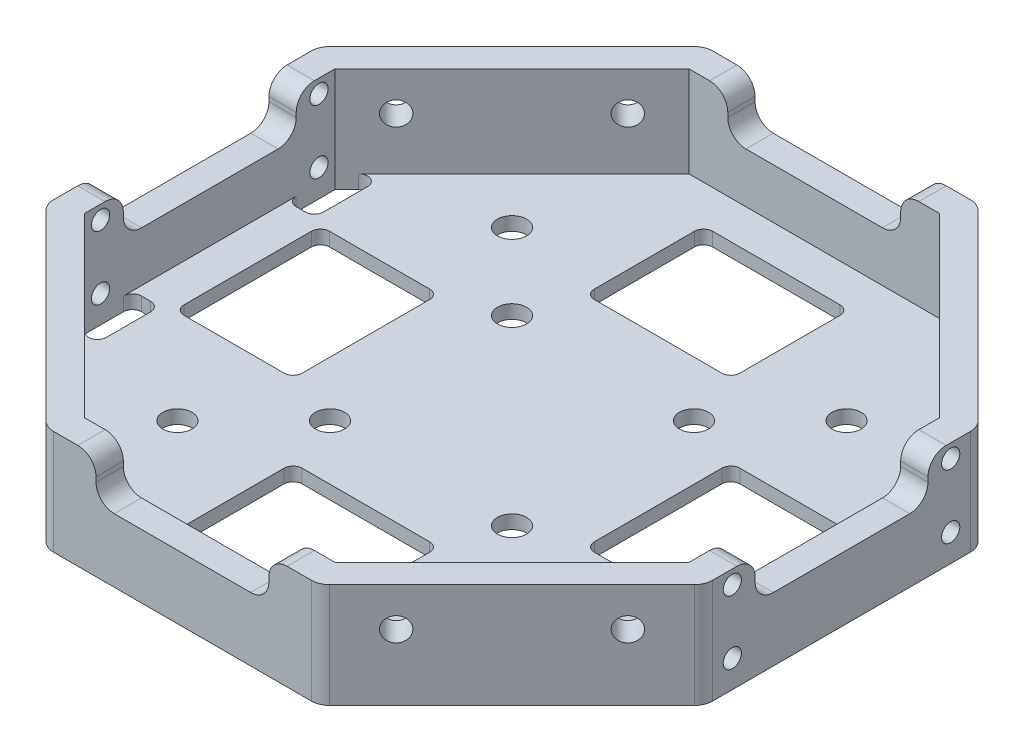
from build123d import *

# Parameters (mm, degrees)
BOSS_EXTRUDE1_DEPTH = 11.5
SHELL1_T            = -3
SKETCH3_R           = 1.3
CUT_EXTRUDE1_DEPTH  = 94
SKETCH4_R           = 1.3
CUT_EXTRUDE2_DEPTH  = 94
FILLET1_R           = 2
CUT_EXTRUDE3_DEPTH  = 79
CUT_EXTRUDE4_DEPTH  = 79
FILLET2_R           = 2
SKETCH7_R           = 1.6
CUT_EXTRUDE5_DEPTH  = 10
SKETCH8_R           = 1
CUT_EXTRUDE7_DEPTH  = 79
CUT_EXTRUDE8_DEPTH  = 1.5
CUT_EXTRUDE9_DEPTH  = 1.5
FILLET3_R           = 1
CUT_EXTRUDE10_DEPTH = 10
FILLET4_R           = 1
SKETCH14_R          = 1.6
CUT_EXTRUDE11_DEPTH = 10


with BuildPart() as part:
    # Sketch1 → Boss-Extrude1 (new body)
    with BuildSketch(Plane(origin=(0, 0, 0), x_dir=(1, 0, 0), z_dir=(0, 1, 0))):
        Polygon((-11.213203436, 40), (18.786796564, 40), (40, 18.786796564), (40, -11.213203436), (18.786796564, -32.426406871), (-11.213203436, -32.426406871), (-32.426406871, -11.213203436), (-32.426406871, 18.786796564), align=None)
    extrude(amount=BOSS_EXTRUDE1_DEPTH)

    # Shell1
    shell1_openings = [part.faces().sort_by_distance(p)[0] for p in [
        (3.786796564, 11.5, -3.786796564),
    ]]
    offset(amount=SHELL1_T, openings=shell1_openings, kind=Kind.INTERSECTION)

    # Sketch3 → Cut-Extrude1 (cut)
    with BuildSketch(Plane(origin=(-21.819805153, 0, 21.819805153), x_dir=(0.7071067811865558, 0, 0.7071067811865392), z_dir=(-0.7071067811865392, 0, 0.7071067811865558))):
        with Locations((-9, 7.25)):
            Circle(SKETCH3_R)
        with Locations((9, 7.25)):
            Circle(SKETCH3_R)
    extrude(amount=-CUT_EXTRUDE1_DEPTH, mode=Mode.SUBTRACT)

    # Sketch4 → Cut-Extrude2 (cut)
    with BuildSketch(Plane(origin=(-25.606601718, 0, -25.606601718), x_dir=(-0.7071067811865556, 0, 0.7071067811865396), z_dir=(-0.7071067811865396, 0, -0.7071067811865556))):
        with Locations((-14.355339059, 7.25)):
            Circle(SKETCH4_R)
        with Locations((3.644660941, 7.25)):
            Circle(SKETCH4_R)
    extrude(amount=-CUT_EXTRUDE2_DEPTH, mode=Mode.SUBTRACT)

    # Fillet1
    fillet1_edges = [part.edges().sort_by_distance(p)[0] for p in [
        (40, 5.75, -18.786796564),
        (40, 5.75, 11.213203436),
        (18.786796564, 5.75, 32.426406871),
        (-11.213203436, 5.75, 32.426406871),
        (-32.426406871, 5.75, 11.213203436),
        (-32.426406871, 5.75, -18.786796564),
        (-11.213203436, 5.75, -40),
        (18.786796564, 5.75, -40),
    ]]
    fillet(fillet1_edges, radius=FILLET1_R)

    # Sketch5 → Cut-Extrude3 (cut)
    with BuildSketch(Plane.XY.offset(32.426406871)):
        Polygon((3.786796564, 7), (13.286796564, 7), (13.286796564, 11.5), (-5.713203436, 11.5), (-5.713203436, 7), align=None)
    extrude(amount=-CUT_EXTRUDE3_DEPTH, mode=Mode.SUBTRACT)

    # Sketch6 → Cut-Extrude4 (cut)
    with BuildSketch(Plane.ZY.offset(32.426406871)):
        Polygon((-3.786796564, 7), (5.713203436, 7), (5.713203436, 11.5), (-13.286796564, 11.5), (-13.286796564, 7), align=None)
    extrude(amount=-CUT_EXTRUDE4_DEPTH, mode=Mode.SUBTRACT)

    # Fillet2
    fillet2_edges = [part.edges().sort_by_distance(p)[0] for p in [
        (-5.713203436, 7, -38.5),
        (-5.713203436, 11.5, -38.5),
        (13.286796564, 11.5, -38.5),
        (13.286796564, 7, -38.5),
        (-5.713203436, 7, 30.926406871),
        (-5.713203436, 11.5, 30.926406871),
        (13.286796564, 11.5, 30.926406871),
        (13.286796564, 7, 30.926406871),
        (38.5, 7, -13.286796564),
        (-30.926406871, 7, -13.286796564),
        (38.5, 11.5, -13.286796564),
        (-30.926406871, 11.5, -13.286796564),
        (38.5, 11.5, 5.713203436),
        (-30.926406871, 11.5, 5.713203436),
        (38.5, 7, 5.713203436),
        (-30.926406871, 7, 5.713203436),
    ]]
    fillet(fillet2_edges, radius=FILLET2_R)

    # Sketch7 → Cut-Extrude5 (cut)
    with BuildSketch(Plane(origin=(0, 0, 0), x_dir=(-1, 0, 0), z_dir=(0, -1, 0))):
        with Locations(Location((6.213203436, -6.213203436, 0), (0, 0, 90))):
            Circle(SKETCH7_R)
        with Locations(Location((-13.786796564, -6.213203436, 0), (0, 0, 90))):
            Circle(SKETCH7_R)
        with Locations(Location((-13.786796564, 13.786796564, 0), (0, 0, 90))):
            Circle(SKETCH7_R)
        with Locations(Location((6.213203436, 13.786796564, 0), (0, 0, 90))):
            Circle(SKETCH7_R)
    extrude(amount=-CUT_EXTRUDE5_DEPTH, mode=Mode.SUBTRACT)

    # Sketch8 → Cut-Extrude7 (cut)
    with BuildSketch(Plane(origin=(40, 0, 0), x_dir=(0, 0, -1), z_dir=(1, 0, 0))):
        with Locations((-8.213203436, 10)):
            Circle(SKETCH8_R)
        with Locations((-8.213203436, 3)):
            Circle(SKETCH8_R)
        with Locations((15.786796564, 3)):
            Circle(SKETCH8_R)
        with Locations(Location((15.786796564, 10, 0), (0, 0, 180))):
            Circle(SKETCH8_R)
    extrude(amount=-CUT_EXTRUDE7_DEPTH, mode=Mode.SUBTRACT)

    # Sketch10 → Cut-Extrude8 (cut)
    with BuildSketch(Plane(origin=(0, 3, 0), x_dir=(1, 0, 0), z_dir=(0, 1, 0))):
        Polygon((17.544155877, 37), (37, 17.544155877), (37, -9.970562748), (17.544155877, -29.426406871), (-9.970562748, -29.426406871), (-29.426406871, -9.970562748), (-29.426406871, 17.544155877), (-9.970562748, 37), align=None)
    extrude(amount=-CUT_EXTRUDE8_DEPTH, mode=Mode.SUBTRACT)

    # Sketch12 → Cut-Extrude9 (cut)
    with BuildSketch(Plane(origin=(0, 1.5, 0), x_dir=(1, 0, 0), z_dir=(0, 1, 0))):
        Polygon((-26.426406871, 20.544155877), (-29.426406871, 17.544155877), (-29.426406871, 12.286796564), (-26.426406871, 12.286796564), align=None)
        Polygon((-26.426406871, -4.713203436), (-29.426406871, -4.713203436), (-29.426406871, -9.970562748), (-26.426406871, -12.970562748), align=None)
        Polygon((34, 12.286796564), (37, 12.286796564), (37, 17.544155877), (34, 20.544155877), align=None)
        Polygon((37, -9.970562748), (37, -4.713203436), (34, -4.713203436), (34, -12.970562748), align=None)
    extrude(amount=-CUT_EXTRUDE9_DEPTH, mode=Mode.SUBTRACT)

    # Fillet3
    fillet3_edges = [part.edges().sort_by_distance(p)[0] for p in [
        (-26.426406871, 0.75, 4.713203436),
        (-26.426406871, 0.75, 12.970562748),
        (-29.426406871, 0.75, 4.713203436),
        (34, 0.75, -12.286796564),
        (34, 0.75, -20.544155877),
        (37, 0.75, -12.286796564),
        (37, 0.75, 4.713203436),
        (34, 0.75, 12.970562748),
        (34, 0.75, 4.713203436),
        (-29.426406871, 0.75, -12.286796564),
        (-26.426406871, 0.75, -20.544155877),
        (-26.426406871, 0.75, -12.286796564),
    ]]
    fillet(fillet3_edges, radius=FILLET3_R)

    # Sketch13 → Cut-Extrude10 (cut)
    with BuildSketch(Plane(origin=(0, 1.5, 0), x_dir=(1, 0, 0), z_dir=(0, 1, 0))):
        Polygon((3.786796564, 19.838268012), (-4.213203436, 19.838268012), (-4.213203436, 32.838268012), (2.581997553, 32.838268012), (11.786796564, 32.838268012), (11.786796564, 19.838268012), align=None)
        Polygon((19.838268012, 3.786796564), (19.838268012, -4.213203436), (32.838268012, -4.213203436), (32.838268012, 4.991595576), (32.838268012, 11.786796564), (19.838268012, 11.786796564), align=None)
        Polygon((3.786796564, -12.264674884), (-4.213203436, -12.264674884), (-4.213203436, -25.264674884), (4.991595576, -25.264674884), (11.786796564, -25.264674884), (11.786796564, -12.264674884), align=None)
        Polygon((-12.264674884, 3.786796564), (-12.264674884, 11.786796564), (-25.264674884, 11.786796564), (-25.264674884, 2.581997553), (-25.264674884, -4.213203436), (-12.264674884, -4.213203436), align=None)
    extrude(amount=-CUT_EXTRUDE10_DEPTH, mode=Mode.SUBTRACT)

    # Fillet4
    fillet4_edges = [part.edges().sort_by_distance(p)[0] for p in [
        (11.786796564, 0.75, -19.838268012),
        (-4.213203436, 0.75, -19.838268012),
        (-4.213203436, 0.75, -32.838268012),
        (11.786796564, 0.75, -32.838268012),
        (19.838268012, 0.75, -11.786796564),
        (32.838268012, 0.75, -11.786796564),
        (32.838268012, 0.75, 4.213203436),
        (19.838268012, 0.75, 4.213203436),
        (11.786796564, 0.75, 12.264674884),
        (11.786796564, 0.75, 25.264674884),
        (-4.213203436, 0.75, 25.264674884),
        (-4.213203436, 0.75, 12.264674884),
        (-12.264674884, 0.75, 4.213203436),
        (-25.264674884, 0.75, 4.213203436),
        (-25.264674884, 0.75, -11.786796564),
        (-12.264674884, 0.75, -11.786796564),
    ]]
    fillet(fillet4_edges, radius=FILLET4_R)

    # Sketch14 → Cut-Extrude11 (cut)
    with BuildSketch(Plane(origin=(0, 1.5, 0), x_dir=(1, 0, 0), z_dir=(0, 1, 0))):
        with Locations(Location((-14.597979746, 22.171572875, 0), (0, 0, 270))):
            Circle(SKETCH14_R)
        with Locations(Location((22.171572875, 22.171572875, 0), (0, 0, 270))):
            Circle(SKETCH14_R)
        with Locations(Location((-14.597979746, -14.597979746, 0), (0, 0, 270))):
            Circle(SKETCH14_R)
        with Locations(Location((22.171572875, -14.597979746, 0), (0, 0, 270))):
            Circle(SKETCH14_R)
    extrude(amount=-CUT_EXTRUDE11_DEPTH, mode=Mode.SUBTRACT)


solid = part.part
